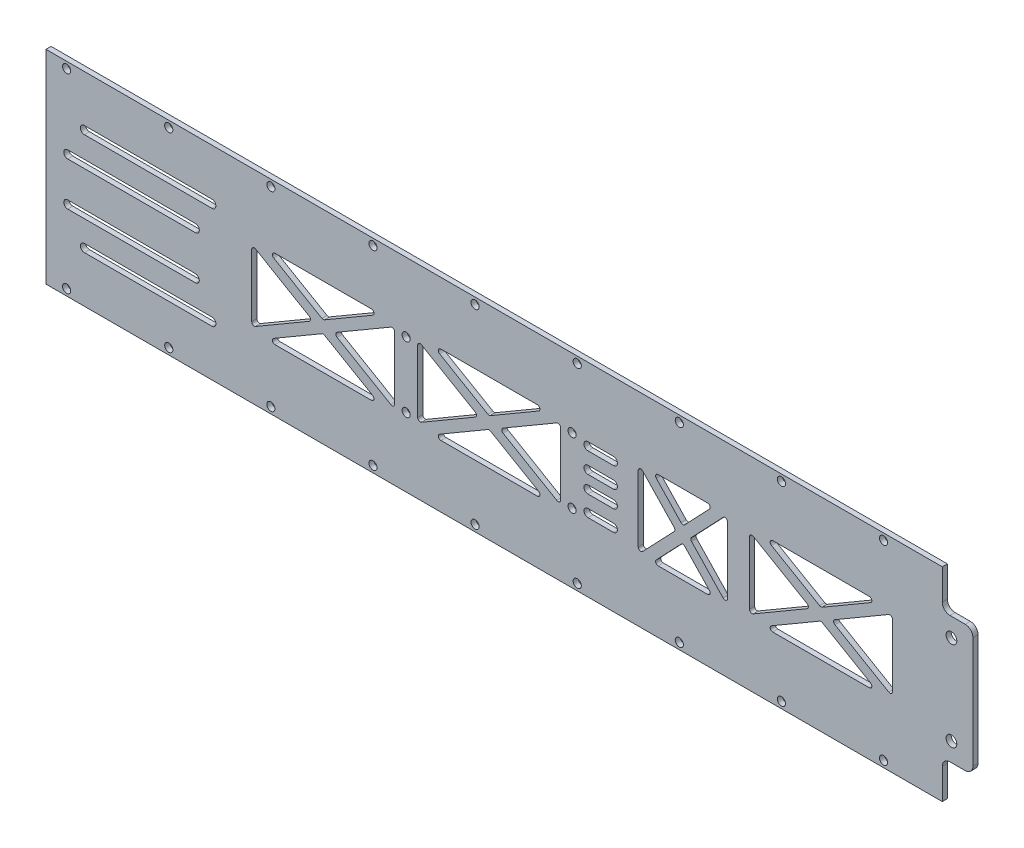
from build123d import *

# Parameters (mm, degrees)
EXTRUDE_1_DEPTH     = 2
SKETCH_2_R          = 1.6
SKETCH_2_R_2        = 2.1
CUT_EXTRUDE_1_DEPTH = 194.650920215
SKETCH_4_W          = 15
SKETCH_4_H          = 35
CUT_EXTRUDE_2_DEPTH = 194.650920215
FILLET_1_R          = 1
SKETCH_7_W          = 56.07225742
SKETCH_7_H          = 35.189041313
EXTRUDE_2_DEPTH     = 2
CUT_EXTRUDE_3_DEPTH = 2
SKETCH_9_W          = 20.999095782
SKETCH_9_H          = 42.428942247
SKETCH_9_W_2        = 20.891408112
SKETCH_9_H_2        = 40.705939516
EXTRUDE_3_DEPTH     = 2
SKETCH_10_W         = 3.915922325
SKETCH_10_H         = 79.66
CUT_EXTRUDE_4_DEPTH = 2
SKETCH_12_W         = 55.351462728
SKETCH_12_H         = 47.167199756
EXTRUDE_4_DEPTH     = 2
CUT_EXTRUDE_5_DEPTH = 2
CUT_EXTRUDE_6_DEPTH = 2
FILLET_2_R          = 1


with BuildPart() as part:
    # 草图1 → 凸台-拉伸1 (new body)
    with BuildSketch(Plane.XY):
        with BuildLine():
            Line((177.5, -27.83), (177.5, -39.83))
            Line((177.5, -39.83), (-177.5, -39.83))
            Line((-177.5, -39.83), (-177.5, 39.83))
            Line((-177.5, 39.83), (177.5, 39.83))
            Line((177.5, 39.83), (177.5, 27.83))
            ThreePointArc((177.5, 27.83), (178.378679656, 25.708679656), (180.5, 24.83))
            Line((180.5, 24.83), (186.5, 24.83))
            ThreePointArc((186.5, 24.83), (188.621320344, 23.951320344), (189.5, 21.83))
            Line((189.5, 21.83), (189.5, -21.83))
            ThreePointArc((189.5, -21.83), (188.621320344, -23.951320344), (186.5, -24.83))
            Line((186.5, -24.83), (180.5, -24.83))
            ThreePointArc((180.5, -24.83), (178.378679656, -25.708679656), (177.5, -27.83))
        make_face()
    extrude(amount=EXTRUDE_1_DEPTH)

    # 草图2 → 切除-拉伸1 (cut, through all)
    with BuildSketch(Plane(origin=(0, 0, 0), x_dir=(-1, 0, 0), z_dir=(0, 0, -1))):
        with Locations((165.5, 37.3)):
            Circle(SKETCH_2_R)
        with Locations((125.5, 37.3)):
            Circle(SKETCH_2_R)
        with Locations((85.5, 37.3)):
            Circle(SKETCH_2_R)
        with Locations((45.5, 37.3)):
            Circle(SKETCH_2_R)
        with Locations((5.5, 37.3)):
            Circle(SKETCH_2_R)
        with Locations((-34.5, 37.3)):
            Circle(SKETCH_2_R)
        with Locations((-74.5, 37.3)):
            Circle(SKETCH_2_R)
        with Locations((-114.5, 37.3)):
            Circle(SKETCH_2_R)
        with Locations((-154.5, 37.3)):
            Circle(SKETCH_2_R)
        with Locations(Location((-154.5, -37.3, 0), (0, 0, 180))):
            Circle(SKETCH_2_R)
        with Locations(Location((-114.5, -37.3, 0), (0, 0, 180))):
            Circle(SKETCH_2_R)
        with Locations(Location((-74.5, -37.3, 0), (0, 0, 180))):
            Circle(SKETCH_2_R)
        with Locations(Location((-34.5, -37.3, 0), (0, 0, 180))):
            Circle(SKETCH_2_R)
        with Locations(Location((5.5, -37.3, 0), (0, 0, 180))):
            Circle(SKETCH_2_R)
        with Locations(Location((45.5, -37.3, 0), (0, 0, 180))):
            Circle(SKETCH_2_R)
        with Locations(Location((85.5, -37.3, 0), (0, 0, 180))):
            Circle(SKETCH_2_R)
        with Locations(Location((125.5, -37.3, 0), (0, 0, 180))):
            Circle(SKETCH_2_R)
        with Locations(Location((165.5, -37.3, 0), (0, 0, 180))):
            Circle(SKETCH_2_R)
        with Locations((-181.1, 17.5)):
            Circle(SKETCH_2_R_2)
        with Locations(Location((-181.1, -17.5, 0), (0, 0, 180))):
            Circle(SKETCH_2_R_2)
        with Locations((141.2, 18.5)):
            Circle(SKETCH_2_R_2)
        with Locations(Location((141.2, -18.5, 0), (0, 0, 180))):
            Circle(SKETCH_2_R_2)
        with Locations((98.9, 17.5)):
            Circle(SKETCH_2_R_2)
        with Locations(Location((98.9, -17.5, 0), (0, 0, 180))):
            Circle(SKETCH_2_R_2)
        with Locations((32.5, 12.83)):
            Circle(SKETCH_2_R)
        with Locations((-32.5, 12.83)):
            Circle(SKETCH_2_R)
        with Locations(Location((-32.5, -12.83, 0), (0, 0, 180))):
            Circle(SKETCH_2_R)
        with Locations(Location((32.5, -12.83, 0), (0, 0, 180))):
            Circle(SKETCH_2_R)
    extrude(amount=-CUT_EXTRUDE_1_DEPTH, mode=Mode.SUBTRACT)

    # 草图4 → 切除-拉伸2 (cut, through all)
    with BuildSketch(Plane.XY.offset(2)):
        Polygon((22.60215886, 15.5), (-22.60215886, 15.5), (0, 2.315407332), align=None)
        Polygon((-3.969269711, 0), (-28, 14.017926002), (-28, -14.017926002), align=None)
        Polygon((28, 14.017926002), (3.969269711, 0), (28, -14.017926002), align=None)
        Polygon((22.60215886, -15.5), (0, -2.315407332), (-22.60215886, -15.5), align=None)
        Polygon((87.60215886, 15.5), (42.39784114, 15.5), (65, 2.315407332), align=None)
        Polygon((61.030730289, 0), (37, 14.017926002), (37, -14.017926002), align=None)
        Polygon((93, 14.017926002), (68.969269711, 0), (93, -14.017926002), align=None)
        Polygon((87.60215886, -15.5), (65, -2.315407332), (42.39784114, -15.5), align=None)
        Polygon((-42.39784114, 15.5), (-87.60215886, 15.5), (-65, 2.315407332), align=None)
        Polygon((-68.969269711, 0), (-93, 14.017926002), (-93, -14.017926002), align=None)
        Polygon((-37, 14.017926002), (-61.030730289, 0), (-37, -14.017926002), align=None)
        Polygon((-42.39784114, -15.5), (-65, -2.315407332), (-87.60215886, -15.5), align=None)
        Polygon((152.60215886, 15.5), (107.39784114, 15.5), (130, 2.315407332), align=None)
        Polygon((126.030730289, 0), (102, 14.017926002), (102, -14.017926002), align=None)
        Polygon((152.60215886, -15.5), (130, -2.315407332), (107.39784114, -15.5), align=None)
        Polygon((158, 14.017926002), (133.969269711, 0), (158, -14.017926002), align=None)
        with Locations((-160, 0)):
            Rectangle(SKETCH_4_W, SKETCH_4_H)
        with Locations((-120, 0)):
            Rectangle(SKETCH_4_W, SKETCH_4_H)
    extrude(amount=-CUT_EXTRUDE_2_DEPTH, mode=Mode.SUBTRACT)

    # 圆角1
    fillet_1_edges = [part.edges().sort_by_distance(p)[0] for p in [
        (130, 2.315407332, 1),
        (107.39784114, 15.5, 1),
        (152.60215886, 15.5, 1),
        (-87.60215886, -15.5, 1),
        (-65, -2.315407332, 1),
        (-42.39784114, -15.5, 1),
        (-61.030730289, 0, 1),
        (-37, 14.017926002, 1),
        (-37, -14.017926002, 1),
        (-93, 14.017926002, 1),
        (-68.969269711, 0, 1),
        (-93, -14.017926002, 1),
        (-167.5, 17.5, 1),
        (-152.5, 17.5, 1),
        (-152.5, -17.5, 1),
        (-167.5, -17.5, 1),
        (133.969269711, 0, 1),
        (158, 14.017926002, 1),
        (158, -14.017926002, 1),
        (102, 14.017926002, 1),
        (126.030730289, 0, 1),
        (102, -14.017926002, 1),
        (107.39784114, -15.5, 1),
        (130, -2.315407332, 1),
        (152.60215886, -15.5, 1),
        (65, 2.315407332, 1),
        (42.39784114, 15.5, 1),
        (87.60215886, 15.5, 1),
        (-22.60215886, -15.5, 1),
        (0, -2.315407332, 1),
        (22.60215886, -15.5, 1),
        (3.969269711, 0, 1),
        (28, 14.017926002, 1),
        (28, -14.017926002, 1),
        (-28, 14.017926002, 1),
        (-3.969269711, 0, 1),
        (-28, -14.017926002, 1),
        (-65, 2.315407332, 1),
        (-87.60215886, 15.5, 1),
        (-42.39784114, 15.5, 1),
        (42.39784114, -15.5, 1),
        (65, -2.315407332, 1),
        (87.60215886, -15.5, 1),
        (68.969269711, 0, 1),
        (93, 14.017926002, 1),
        (93, -14.017926002, 1),
        (37, 14.017926002, 1),
        (61.030730289, 0, 1),
        (37, -14.017926002, 1),
        (-112.5, -17.5, 1),
        (-127.5, -17.5, 1),
        (-127.5, 17.5, 1),
        (-112.5, 17.5, 1),
        (0, 2.315407332, 1),
        (-22.60215886, 15.5, 1),
        (22.60215886, 15.5, 1),
    ]]
    fillet(fillet_1_edges, radius=FILLET_1_R)

    # 草图7 → 凸台-拉伸2 (add)
    with BuildSketch(Plane.XY):
        with Locations((65.03612871, -0.276350443)):
            Rectangle(SKETCH_7_W, SKETCH_7_H)
    extrude(amount=EXTRUDE_2_DEPTH)

    # 草图8 → 切除-拉伸3 (cut)
    with BuildSketch(Plane.XY):
        with BuildLine():
            Line((38.7, -1.78), (48.7, -1.78))
            ThreePointArc((48.7, -1.78), (50.25, -3.33), (48.7, -4.88))
            Line((48.7, -4.88), (38.7, -4.88))
            ThreePointArc((38.7, -4.88), (37.15, -3.33), (38.7, -1.78))
        make_face()
        with BuildLine():
            Line((38.7, -9.78), (48.7, -9.78))
            ThreePointArc((48.7, -9.78), (50.25, -11.33), (48.7, -12.88))
            Line((48.7, -12.88), (38.7, -12.88))
            ThreePointArc((38.7, -12.88), (37.15, -11.33), (38.7, -9.78))
        make_face()
        with BuildLine():
            Line((38.7, 9.78), (48.7, 9.78))
            ThreePointArc((48.7, 9.78), (50.25, 11.33), (48.7, 12.88))
            Line((48.7, 12.88), (38.7, 12.88))
            ThreePointArc((38.7, 12.88), (37.15, 11.33), (38.7, 9.78))
        make_face()
        with BuildLine():
            Line((38.7, 1.78), (48.7, 1.78))
            ThreePointArc((48.7, 1.78), (50.25, 3.33), (48.7, 4.88))
            Line((48.7, 4.88), (38.7, 4.88))
            ThreePointArc((38.7, 4.88), (37.15, 3.33), (38.7, 1.78))
        make_face()
    extrude(amount=CUT_EXTRUDE_3_DEPTH, mode=Mode.SUBTRACT)

    # 草图9 → 凸台-拉伸3 (add)
    with BuildSketch(Plane.XY):
        with Locations((-159.883542156, -0.386877903)):
            Rectangle(SKETCH_9_W, SKETCH_9_H)
        with Locations((-120.739073865, -0.171502561)):
            Rectangle(SKETCH_9_W_2, SKETCH_9_H_2)
    extrude(amount=EXTRUDE_3_DEPTH)

    # 草图10 → 切除-拉伸4 (cut)
    with BuildSketch(Plane.XY.offset(2)):
        with Locations((-175.542038838, 0)):
            Rectangle(SKETCH_10_W, SKETCH_10_H)
    extrude(amount=-CUT_EXTRUDE_4_DEPTH, mode=Mode.SUBTRACT)

    # 草图12 → 凸台-拉伸4 (add)
    with BuildSketch(Plane.XY.offset(2)):
        with Locations((-122.856022915, 1.644712079)):
            Rectangle(SKETCH_12_W, SKETCH_12_H)
    extrude(amount=-EXTRUDE_4_DEPTH)

    # 草图13 → 切除-拉伸5 (cut)
    with BuildSketch(Plane.XY.offset(2)):
        with BuildLine():
            Line((-158.584077675, 21.5), (-108.584077675, 21.5))
            ThreePointArc((-108.584077675, 21.5), (-107.034077675, 19.95), (-108.584077675, 18.4))
            Line((-108.584077675, 18.4), (-158.584077675, 18.4))
            ThreePointArc((-158.584077675, 18.4), (-160.134077675, 19.95), (-158.584077675, 21.5))
        make_face()
        with BuildLine():
            Line((-165.084077675, 10), (-115.084077675, 10))
            ThreePointArc((-115.084077675, 10), (-113.534077675, 8.45), (-115.084077675, 6.9))
            Line((-115.084077675, 6.9), (-165.084077675, 6.9))
            ThreePointArc((-165.084077675, 6.9), (-166.634077675, 8.45), (-165.084077675, 10))
        make_face()
        with BuildLine():
            Line((-165.084077675, -7), (-115.084077675, -7))
            ThreePointArc((-115.084077675, -7), (-113.534077675, -8.55), (-115.084077675, -10.1))
            Line((-115.084077675, -10.1), (-165.084077675, -10.1))
            ThreePointArc((-165.084077675, -10.1), (-166.634077675, -8.55), (-165.084077675, -7))
        make_face()
        with BuildLine():
            Line((-158.584077675, -18.5), (-108.584077675, -18.5))
            ThreePointArc((-108.584077675, -18.5), (-107.034077675, -20.05), (-108.584077675, -21.6))
            Line((-108.584077675, -21.6), (-158.584077675, -21.6))
            ThreePointArc((-158.584077675, -21.6), (-160.134077675, -20.05), (-158.584077675, -18.5))
        make_face()
    extrude(amount=-CUT_EXTRUDE_5_DEPTH, mode=Mode.SUBTRACT)

    # 草图14 → 切除-拉伸6 (cut)
    with BuildSketch(Plane.XY):
        Polygon((58.397451054, 15.5), (73.151415451, 0), (58.397451054, -15.5), align=None)
        Polygon((78.643486656, 0), (93.397451054, 15.5), (93.397451054, -15.5), align=None)
        Polygon((63.889522258, -15.5), (87.905379849, -15.5), (75.897451054, -2.884889152), align=None)
        Polygon((75.897451054, 2.884889152), (87.905379849, 15.5), (63.889522258, 15.5), align=None)
    extrude(amount=CUT_EXTRUDE_6_DEPTH, mode=Mode.SUBTRACT)

    # 圆角2
    fillet_2_edges = [part.edges().sort_by_distance(p)[0] for p in [
        (87.905379849, -15.5, 1),
        (75.897451054, -2.884889152, 1),
        (63.889522258, -15.5, 1),
        (93.397451054, 15.5, 1),
        (78.643486656, 0, 1),
        (93.397451054, -15.5, 1),
        (75.897451054, 2.884889152, 1),
        (87.905379849, 15.5, 1),
        (63.889522258, 15.5, 1),
        (73.151415451, 0, 1),
        (58.397451054, 15.5, 1),
        (58.397451054, -15.5, 1),
    ]]
    fillet(fillet_2_edges, radius=FILLET_2_R)


solid = part.part
